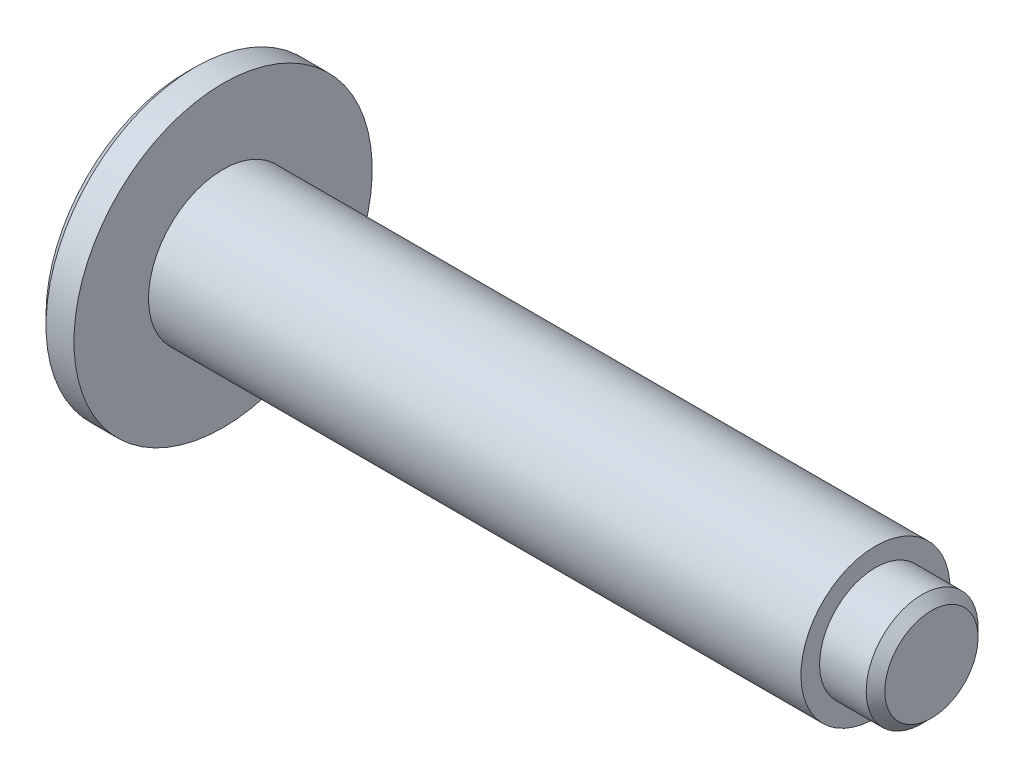
from build123d import *

# Parameters (mm, degrees)
CHAMFER_1_SIZE = 0.5


with BuildPart() as part:
    # 草图1 → 旋转1 (revolve)
    with BuildSketch(Plane.XY):
        Polygon((-12.301369863, 0.334637965), (-12.301369863, 8.334637965), (-10.301369863, 8.334637965), (-10.301369863, 4.334637965), (24.698630137, 4.334637965), (24.698630137, 3.334637965), (27.698630137, 3.334637965), (27.698630137, 0.334637965), align=None)
    revolve(axis=Axis((27.698630137, 0.334637965, 0), (-1, 0, 0)))

    # 倒角1
    chamfer_1_edges = [part.edges().sort_by_distance(p)[0] for p in [
        (27.698630137, -2.665362035, 0),
        (-12.301369863, -7.665362035, 0),
    ]]
    chamfer(chamfer_1_edges, length=CHAMFER_1_SIZE)


solid = part.part
